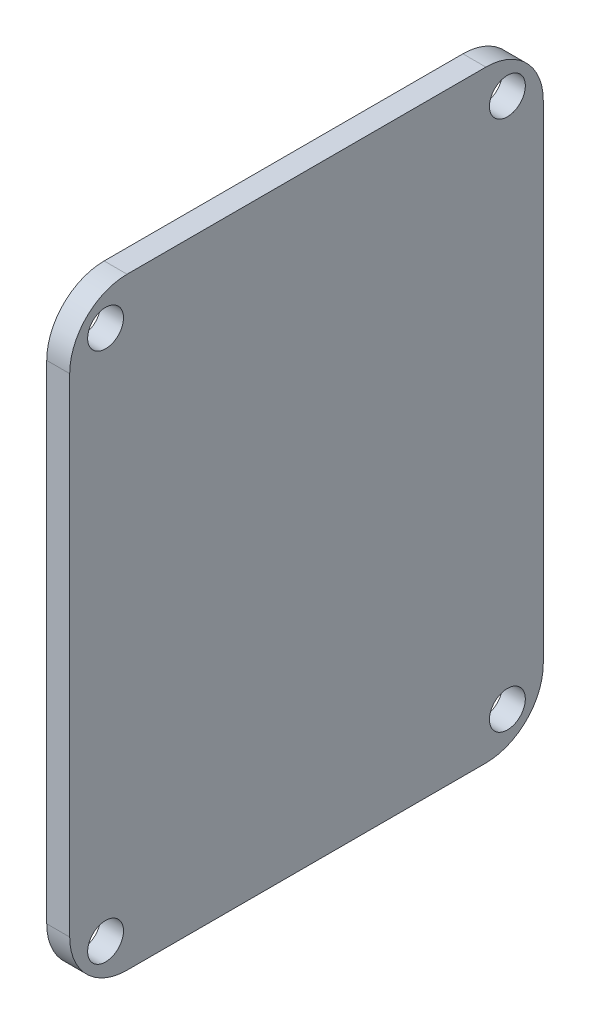
from build123d import *

# Parameters (mm, degrees)
SKETCH2_R           = 1.25
BOSS_EXTRUDE1_DEPTH = 1.6


with BuildPart() as part:
    # Sketch2 → Boss-Extrude1 (new body)
    with BuildSketch(Plane.YZ):
        with BuildLine():
            Line((-17, -16.5), (17, -16.5))
            ThreePointArc((17, -16.5), (19.828427125, -15.328427125), (21, -12.5))
            Line((21, -12.5), (21, 12.5))
            ThreePointArc((21, 12.5), (19.828427125, 15.328427125), (17, 16.5))
            Line((17, 16.5), (-17, 16.5))
            ThreePointArc((-17, 16.5), (-19.828427125, 15.328427125), (-21, 12.5))
            Line((-21, 12.5), (-21, -12.5))
            ThreePointArc((-21, -12.5), (-19.828427125, -15.328427125), (-17, -16.5))
        make_face()
        with Locations(Location((-18.5, 14, 0), (0, 0, 270))):
            Circle(SKETCH2_R, mode=Mode.SUBTRACT)
        with Locations(Location((-18.5, -14, 0), (0, 0, 270))):
            Circle(SKETCH2_R, mode=Mode.SUBTRACT)
        with Locations(Location((18.5, 14, 0), (0, 0, 270))):
            Circle(SKETCH2_R, mode=Mode.SUBTRACT)
        with Locations(Location((18.5, -14, 0), (0, 0, 270))):
            Circle(SKETCH2_R, mode=Mode.SUBTRACT)
    extrude(amount=BOSS_EXTRUDE1_DEPTH)


solid = part.part
